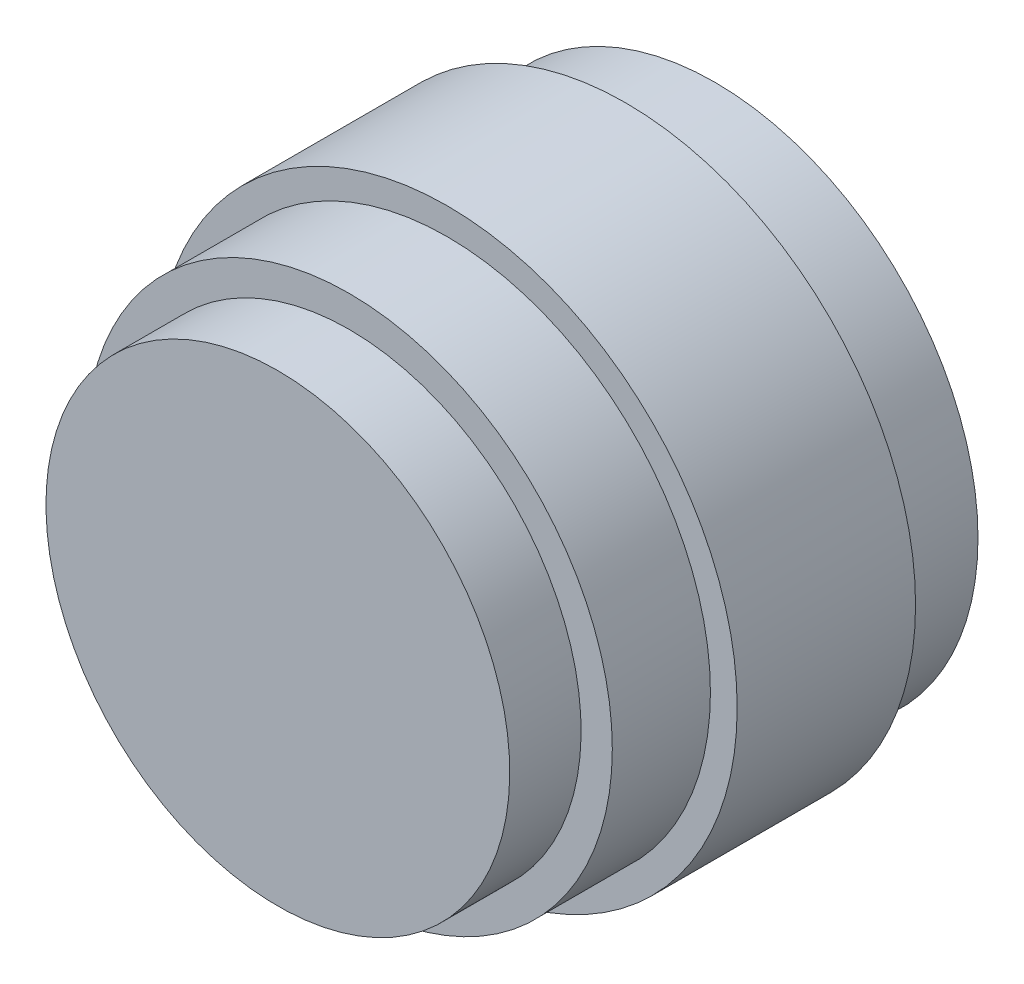
from build123d import *


with BuildPart() as part:
    # Sketch2 → Revolve3 (revolve)
    with BuildSketch(Plane(origin=(0, 0, 0), x_dir=(0, 0, -1), z_dir=(1, 0, 0))):
        Polygon((0, 29.5), (-10, 29.5), (-10, 32.5), (-30, 32.5), (-30, 29.5), (-41, 29.5), (-41, 26), (-49, 26), (-49, 0), (0, 0), align=None)
    revolve(axis=Axis((0, 0, 0), (0, 0, 1)))


solid = part.part
